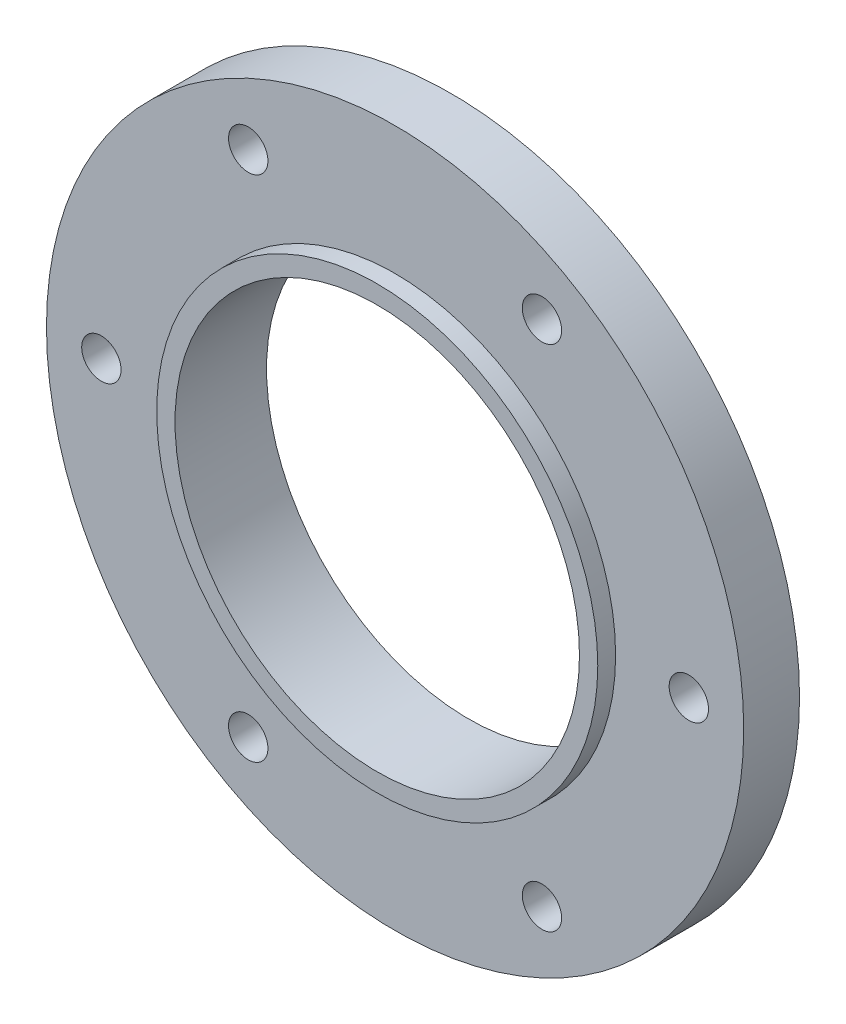
from build123d import *

# Parameters (mm, degrees)
SKETCH_3_R          = 2.15
CUT_EXTRUDE_2_DEPTH = 10


with BuildPart() as part:
    # 草图1 → 旋转1 (revolve)
    with BuildSketch(Plane(origin=(0, 0, 0), x_dir=(1, 0, 0), z_dir=(0, 1, 0))):
        Polygon((24.1, 0), (38.1, 0), (38.1, 6.1), (24.1, 6.1), (24.1, 8.05), (22.1, 8.05), (22.1, -1.95), (24.1, -1.95), align=None)
    revolve(axis=Axis((0, 0, 0), (0, 0, -1)))

    # 草图3 → 切除-拉伸2 (cut)
    with BuildSketch(Plane(origin=(0, 0, -6.1), x_dir=(-1, 0, 0), z_dir=(0, 0, -1))):
        with Locations((-32.1, 0)):
            Circle(SKETCH_3_R)
        with Locations((-16.05, 27.799415461)):
            Circle(SKETCH_3_R)
        with Locations((16.05, 27.799415461)):
            Circle(SKETCH_3_R)
        with Locations((32.1, 0)):
            Circle(SKETCH_3_R)
        with Locations((16.05, -27.799415461)):
            Circle(SKETCH_3_R)
        with Locations((-16.05, -27.799415461)):
            Circle(SKETCH_3_R)
    extrude(amount=-CUT_EXTRUDE_2_DEPTH, mode=Mode.SUBTRACT)


solid = part.part
